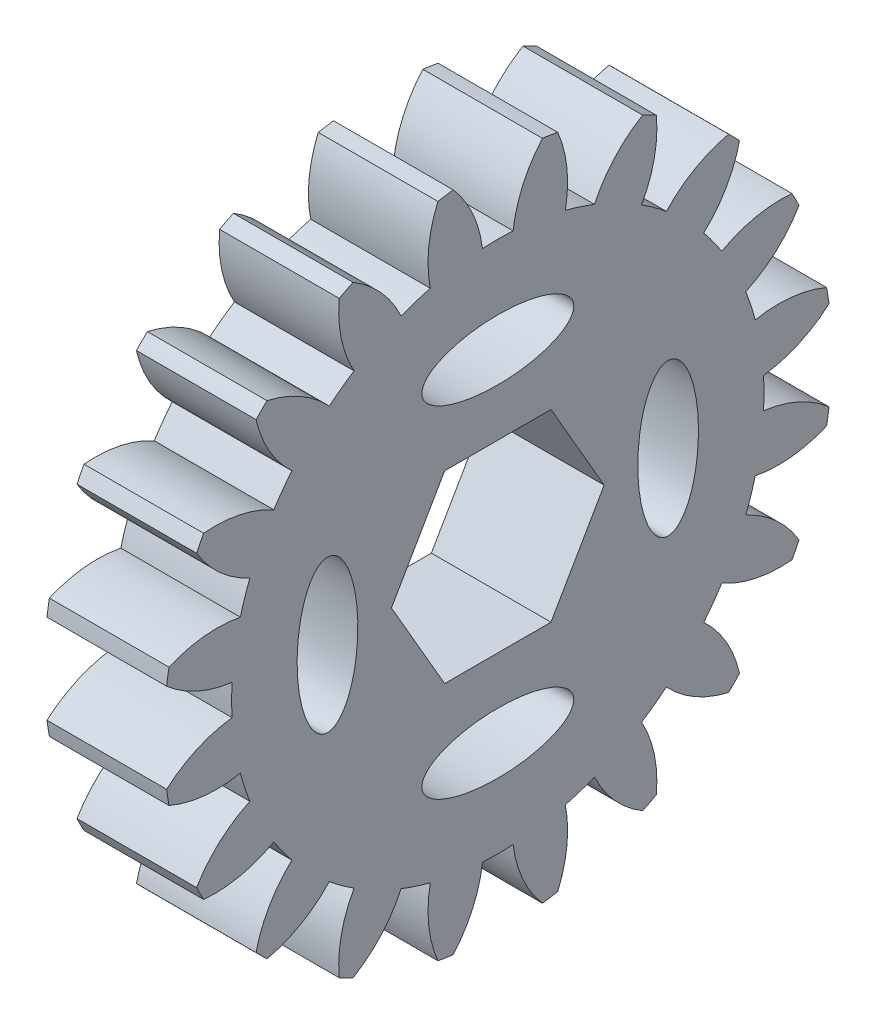
from build123d import *

# Parameters (mm, degrees)
BASPROSKE_W        = 4.99999
BASPROSKE_H        = 13.97
TOOTHCUT_DEPTH     = 21.379443074
TEETHCUTS_COUNT    = 20
TEETHCUTS_ANGLE    = 342
BORSKE_R           = 0.396875
BORE_DEPTH         = 50.8000508
CUT_EXTRUDE1_DEPTH = 21.207983979
SKETCH2_RX         = 3.175
SKETCH2_RY         = 1.27
CUT_EXTRUDE2_DEPTH = 21.207983979
CIRPATTERN1_COUNT  = 4


with BuildPart() as part:
    # BasProSke → Base-Revolve (revolve)
    with BuildSketch(Plane(origin=(0, 0, 0), x_dir=(1, 0, 0), z_dir=(0, 1, 0)), mode=Mode.PRIVATE) as base_revolve_sk:
        with Locations((2.499995, 6.985)):
            Rectangle(BASPROSKE_W, BASPROSKE_H)
    revolve(base_revolve_sk.sketch.rotate(Axis((-10, 0, 0), (1, 0, 0)), 180), axis=Axis((-10, 0, 0), (1, 0, 0)))

    # TooCutSke → ToothCut (cut, through all)
    with BuildSketch(Plane(origin=(0, 0, 0), x_dir=(0, 0, -1), z_dir=(1, 0, 0))):
        with BuildLine():
            ThreePointArc((0.64046545, 11.106749257), (0, 11.1252), (-0.64046545, 11.106749257))
            ThreePointArc((-0.64046545, 11.106749257), (-1.052455812, 12.582227662), (-1.8855699, 13.867798935))
            ThreePointArc((-1.8855699, 13.867798935), (0, 13.9954), (1.8855699, 13.867798935))
            ThreePointArc((1.8855699, 13.867798935), (1.052455812, 12.582227662), (0.64046545, 11.106749257))
        make_face()
    toothcut = extrude(amount=TOOTHCUT_DEPTH, mode=Mode.SUBTRACT)

    # TeethCuts: ToothCut ×20 about axis
    teethcuts_axis = Axis((-10, 0, 0), (1, 0, 0))
    for i in range(1, TEETHCUTS_COUNT):
        add(toothcut.rotate(teethcuts_axis, i * TEETHCUTS_ANGLE / (TEETHCUTS_COUNT - 1)), mode=Mode.SUBTRACT)

    # BorSke → Bore (cut, symmetric)
    with BuildSketch(Plane(origin=(0, 0, 0), x_dir=(0, 0, -1), z_dir=(1, 0, 0))):
        with Locations(Location((0, 0, 0), (0, 0, 180))):
            Circle(BORSKE_R)
    extrude(amount=BORE_DEPTH, both=True, mode=Mode.SUBTRACT)

    # Sketch1 → Cut-Extrude1 (cut, through all)
    with BuildSketch(Plane(origin=(4.99999, 0, 0), x_dir=(0, 0, -1), z_dir=(1, 0, 0))):
        Polygon((2.2225, 3.84948292), (-2.2225, 3.84948292), (-4.445, 0), (-2.2225, -3.84948292), (2.2225, -3.84948292), (4.445, 0), align=None)
    extrude(amount=-CUT_EXTRUDE1_DEPTH, mode=Mode.SUBTRACT)

    # Sketch2 → Cut-Extrude2 (cut, through all)
    with BuildSketch(Plane(origin=(4.99999, 0, 0), x_dir=(0, 0, -1), z_dir=(1, 0, 0))):
        with Locations(Location((0, 7.11948292), (0, 0, 180))):
            Ellipse(SKETCH2_RX, SKETCH2_RY)
    cut_extrude2 = extrude(amount=-CUT_EXTRUDE2_DEPTH, mode=Mode.SUBTRACT)

    # CirPattern1: Cut-Extrude2 ×4 about axis
    cirpattern1_axis = Axis((4.99999, 0, 0), (-1, 0, 0))
    for i in range(1, CIRPATTERN1_COUNT):
        add(cut_extrude2.rotate(cirpattern1_axis, i * 360 / CIRPATTERN1_COUNT), mode=Mode.SUBTRACT)


solid = part.part
